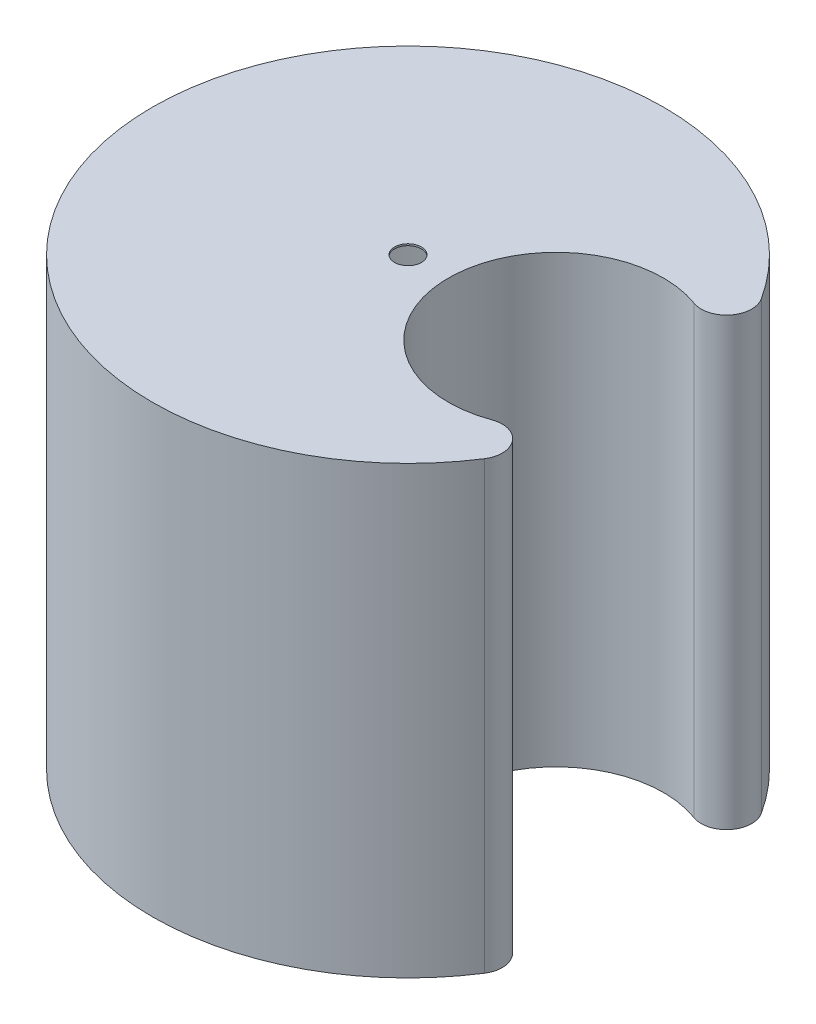
from build123d import *

# Parameters (mm, degrees)
CUT_EXTRUDE1_DEPTH = 136.422799192
SHELL1_T           = -0.396875
SKETCH3_R          = 3.175
CUT_EXTRUDE2_DEPTH = 136.114809977


with BuildPart() as part:
    # Sketch1 → Revolve1 (revolve)
    with BuildSketch(Plane.XY, mode=Mode.PRIVATE) as revolve1_sk:
        Polygon((0, 105.171875), (60.325, 105.171875), (60.325, 0), (59.928125, 0), (0, 0), align=None)
    revolve(revolve1_sk.sketch.rotate(Axis((0, 0, 0), (0, 1, 0)), 90), axis=Axis((0, 0, 0), (0, 1, 0)))

    # Sketch2 → Cut-Extrude1 (cut, through all)
    with BuildSketch(Plane(origin=(0, 105.171875, 0), x_dir=(1, 0, 0), z_dir=(0, 1, 0))):
        with BuildLine():
            ThreePointArc((43.664470656, 23.849143646), (9.525, 0), (43.664470656, -23.849143646))
            ThreePointArc((43.664470656, -23.849143646), (50.360604205, -25.718912301), (50.717833444, -32.662011508))
            ThreePointArc((50.717833444, -32.662011508), (60.325, 0), (50.717833444, 32.662011508))
            ThreePointArc((50.717833444, 32.662011508), (50.360604205, 25.718912301), (43.664470656, 23.849143646))
        make_face()
    extrude(amount=-CUT_EXTRUDE1_DEPTH, mode=Mode.SUBTRACT)

    # Shell1
    shell1_openings = [part.faces().sort_by_distance(p)[0] for p in [
        (-8.714175157, 0, 0),
    ]]
    offset(amount=SHELL1_T, openings=shell1_openings, kind=Kind.INTERSECTION)

    # Sketch3 → Cut-Extrude2 (cut, through all)
    with BuildSketch(Plane.XZ.offset(-104.775)):
        with Locations(Location((0, 0, 0), (0, 0, 270))):
            Circle(SKETCH3_R)
    extrude(amount=-CUT_EXTRUDE2_DEPTH, mode=Mode.SUBTRACT)


solid = part.part
